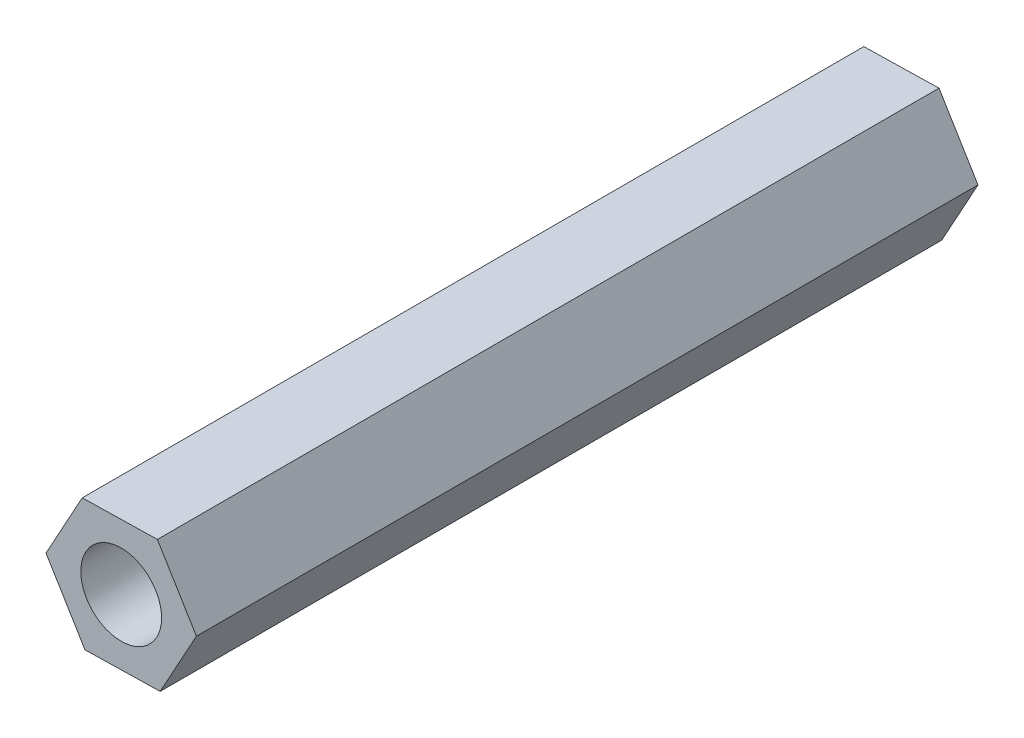
from build123d import *

# Parameters (mm, degrees)
SKETCH1_R           = 1.55
BOSS_EXTRUDE1_DEPTH = 30


with BuildPart() as part:
    # Sketch1 → Boss-Extrude1 (new body)
    with BuildSketch(Plane.XY):
        Polygon((1.389811404, 2.530169479), (-1.496285343, 2.468696722), (-2.886096747, -0.061472757), (-1.389811404, -2.530169479), (1.496285343, -2.468696722), (2.886096747, 0.061472757), align=None)
        Circle(SKETCH1_R, mode=Mode.SUBTRACT)
    extrude(amount=BOSS_EXTRUDE1_DEPTH)


solid = part.part
